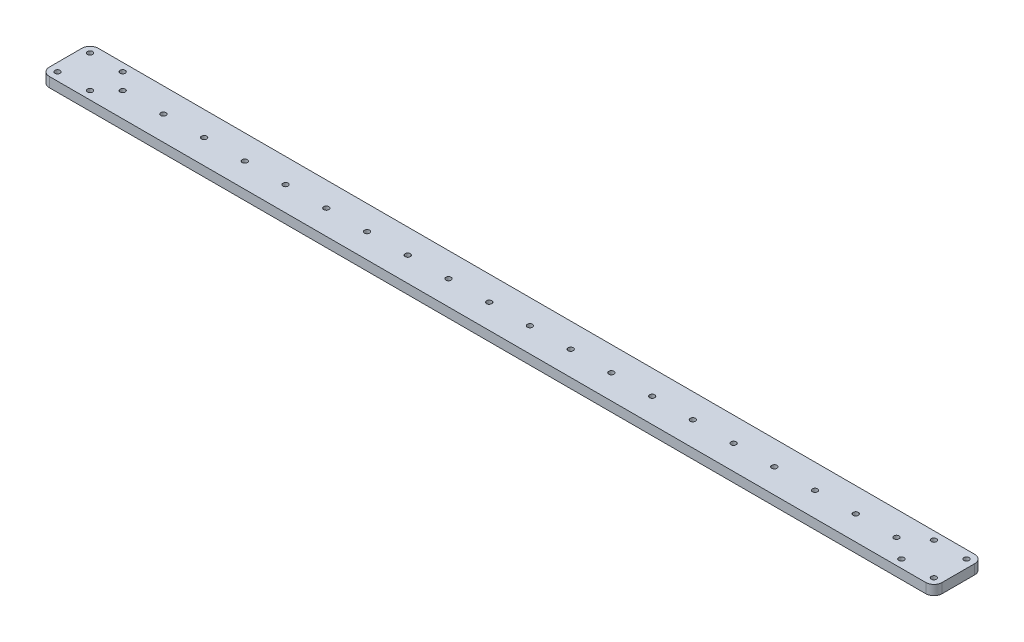
from build123d import *

# Parameters (mm, degrees)
SKETCH5_W           = 548
SKETCH5_H           = 30
SKETCH5_R           = 1.6
BOSS_EXTRUDE1_DEPTH = 6
FILLET1_R           = 5


with BuildPart() as part:
    # Sketch5 → Boss-Extrude1 (new body)
    with BuildSketch(Plane(origin=(0, 0, 0), x_dir=(1, 0, 0), z_dir=(0, 1, 0))):
        with Locations((-259, 0)):
            Rectangle(SKETCH5_W, SKETCH5_H)
        with Locations(Location((-10, 10, 0), (0, 0, 270))):
            Circle(SKETCH5_R, mode=Mode.SUBTRACT)
        with Locations(Location((10, 10, 0), (0, 0, 270))):
            Circle(SKETCH5_R, mode=Mode.SUBTRACT)
        with Locations(Location((10, -10, 0), (0, 0, 270))):
            Circle(SKETCH5_R, mode=Mode.SUBTRACT)
        with Locations(Location((-10, -10, 0), (0, 0, 270))):
            Circle(SKETCH5_R, mode=Mode.SUBTRACT)
        with Locations(Location((-508, -10, 0), (0, 0, 270))):
            Circle(SKETCH5_R, mode=Mode.SUBTRACT)
        with Locations(Location((-508, 10, 0), (0, 0, 270))):
            Circle(SKETCH5_R, mode=Mode.SUBTRACT)
        with Locations(Location((-528, 10, 0), (0, 0, 270))):
            Circle(SKETCH5_R, mode=Mode.SUBTRACT)
        with Locations(Location((-528, -10, 0), (0, 0, 270))):
            Circle(SKETCH5_R, mode=Mode.SUBTRACT)
        with Locations(Location((-498, 0, 0), (0, 0, 270))):
            Circle(SKETCH5_R, mode=Mode.SUBTRACT)
        with Locations(Location((-472.998921612, 0, 0), (0, 0, 270))):
            Circle(SKETCH5_R, mode=Mode.SUBTRACT)
        with Locations(Location((-447.997843225, 0, 0), (0, 0, 270))):
            Circle(SKETCH5_R, mode=Mode.SUBTRACT)
        with Locations(Location((-422.996764837, 0, 0), (0, 0, 270))):
            Circle(SKETCH5_R, mode=Mode.SUBTRACT)
        with Locations(Location((-397.995686449, 0, 0), (0, 0, 270))):
            Circle(SKETCH5_R, mode=Mode.SUBTRACT)
        with Locations(Location((-372.994608062, 0, 0), (0, 0, 270))):
            Circle(SKETCH5_R, mode=Mode.SUBTRACT)
        with Locations(Location((-347.993529674, 0, 0), (0, 0, 270))):
            Circle(SKETCH5_R, mode=Mode.SUBTRACT)
        with Locations(Location((-322.992451286, 0, 0), (0, 0, 270))):
            Circle(SKETCH5_R, mode=Mode.SUBTRACT)
        with Locations(Location((-297.991372899, 0, 0), (0, 0, 270))):
            Circle(SKETCH5_R, mode=Mode.SUBTRACT)
        with Locations(Location((-272.990294511, 0, 0), (0, 0, 270))):
            Circle(SKETCH5_R, mode=Mode.SUBTRACT)
        with Locations(Location((-247.989216123, 0, 0), (0, 0, 270))):
            Circle(SKETCH5_R, mode=Mode.SUBTRACT)
        with Locations(Location((-222.988137735, 0, 0), (0, 0, 270))):
            Circle(SKETCH5_R, mode=Mode.SUBTRACT)
        with Locations(Location((-197.987059348, 0, 0), (0, 0, 270))):
            Circle(SKETCH5_R, mode=Mode.SUBTRACT)
        with Locations(Location((-172.98598096, 0, 0), (0, 0, 270))):
            Circle(SKETCH5_R, mode=Mode.SUBTRACT)
        with Locations(Location((-147.984902572, 0, 0), (0, 0, 270))):
            Circle(SKETCH5_R, mode=Mode.SUBTRACT)
        with Locations(Location((-122.983824185, 0, 0), (0, 0, 270))):
            Circle(SKETCH5_R, mode=Mode.SUBTRACT)
        with Locations(Location((-97.982745797, 0, 0), (0, 0, 270))):
            Circle(SKETCH5_R, mode=Mode.SUBTRACT)
        with Locations(Location((-72.981667409, 0, 0), (0, 0, 270))):
            Circle(SKETCH5_R, mode=Mode.SUBTRACT)
        with Locations(Location((-47.980589022, 0, 0), (0, 0, 270))):
            Circle(SKETCH5_R, mode=Mode.SUBTRACT)
        with Locations(Location((-22.979510634, 0, 0), (0, 0, 270))):
            Circle(SKETCH5_R, mode=Mode.SUBTRACT)
    extrude(amount=BOSS_EXTRUDE1_DEPTH)

    # Fillet1
    fillet1_edges = [part.edges().sort_by_distance(p)[0] for p in [
        (-533, 3, 15),
        (-533, 3, -15),
        (15, 3, -15),
        (15, 3, 15),
    ]]
    fillet(fillet1_edges, radius=FILLET1_R)


solid = part.part
